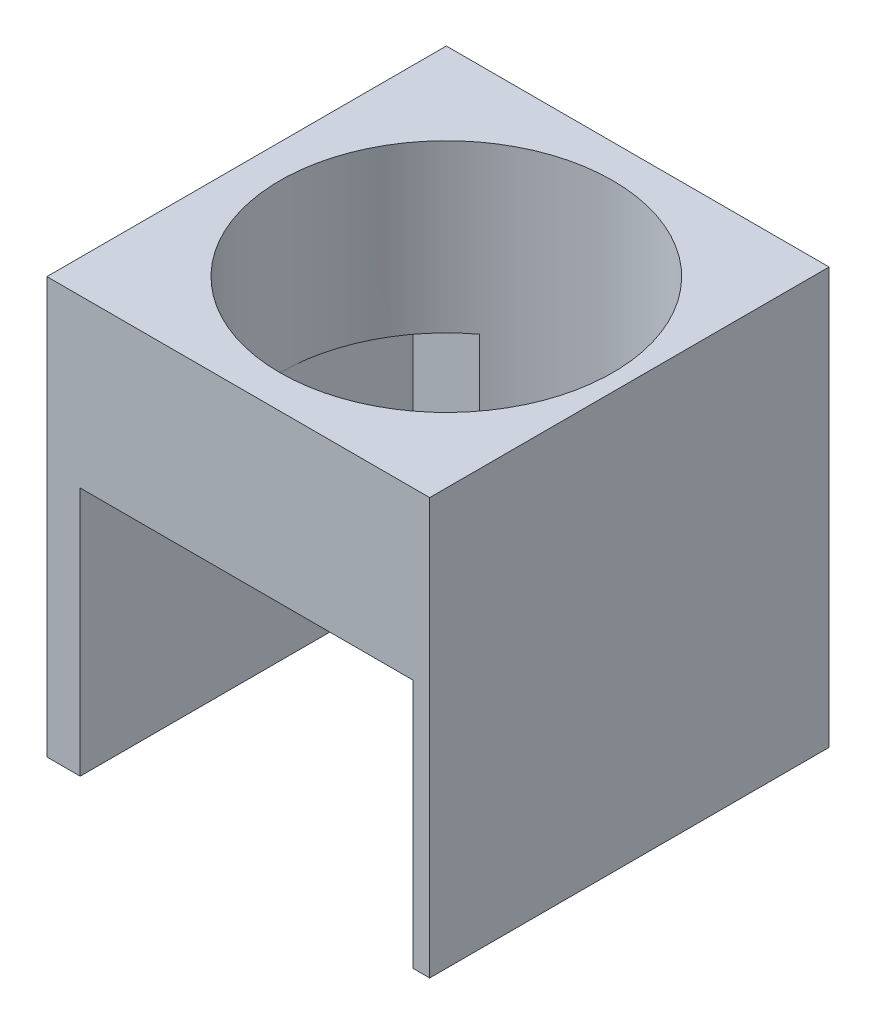
from build123d import *

# Parameters (mm, degrees)
SKETCH1_W                      = 670
SKETCH1_H                      = 120
BOSS_EXTRUDE1_DEPTH            = 530
SKETCH2_W                      = 100
SKETCH2_H                      = 200
SKETCH2_W_2                    = 650
SKETCH2_H_2                    = 250
CUT_EXTRUDE1_DEPTH             = 100
SKETCH3_R                      = 50
CUT_EXTRUDE2_DEPTH             = 260
F_12_0_12_DIAMETER_HOLE2_D     = 12
F_12_0_12_DIAMETER_HOLE2_DEPTH = 30
F_12_0_12_DIAMETER_HOLE2_TIP   = 3.605163714
SKETCH8_W                      = 650
SKETCH8_H                      = 50
BOSS_EXTRUDE2_DEPTH            = 5
SKETCH9_W                      = 10
SKETCH9_H                      = 250
CUT_EXTRUDE3_DEPTH             = 717
CUT_EXTRUDE4_DEPTH             = 5
SKETCH11_W                     = 10
SKETCH11_H                     = 100
BOSS_EXTRUDE3_DEPTH            = 78
BOSS_EXTRUDE3_2_DEPTH          = 78
BOSS_EXTRUDE3_3_DEPTH          = 78
SKETCH12_W                     = 20
SKETCH12_H                     = 30
CUT_EXTRUDE5_DEPTH             = 80
SKETCH15_W                     = 30
SKETCH15_H                     = 23.536156656
SKETCH15_H_2                   = 28.986603691
CUT_EXTRUDE7_DEPTH             = 35
SHELL1_T                       = -3
SKETCH16_W                     = 14
SKETCH16_H                     = 14
CUT_EXTRUDE8_DEPTH             = 35
SKETCH17_W                     = 5.729882812
SKETCH17_H                     = 17.428393554
SKETCH17_W_2                   = 13.369726562
SKETCH17_H_2                   = 3.342431641
BOSS_EXTRUDE4_DEPTH            = 5
SKETCH18_W                     = 670
SKETCH18_H                     = 280
CUT_EXTRUDE10_DEPTH            = 159
CUT_EXTRUDE11_DEPTH            = 863.670273187
CUT_EXTRUDE11_DEPTH_BACK       = 863.670273187
SKETCH19_W                     = 555
SKETCH19_H                     = 250
CUT_EXTRUDE12_DEPTH            = 556.450267801
CUT_EXTRUDE12_DEPTH_BACK       = 556.450267801
SKETCH20_W                     = 115
SKETCH20_H                     = 125


with BuildPart() as part:
    # Sketch1 → Boss-Extrude1 (new body)
    with BuildSketch(Plane(origin=(0, 0, 0), x_dir=(1, 0, 0), z_dir=(0, 1, 0))):
        with Locations((335, 60)):
            Rectangle(SKETCH1_W, SKETCH1_H)
    extrude(amount=BOSS_EXTRUDE1_DEPTH)

    # Sketch2 → Cut-Extrude1 (cut)
    with BuildSketch(Plane.XY):
        with Locations((60, 380)):
            Rectangle(SKETCH2_W, SKETCH2_H)
        with Locations((170, 380)):
            Rectangle(SKETCH2_W, SKETCH2_H)
        with Locations((280, 380)):
            Rectangle(SKETCH2_W, SKETCH2_H)
        with Locations((390, 380)):
            Rectangle(SKETCH2_W, SKETCH2_H)
        with Locations((500, 380)):
            Rectangle(SKETCH2_W, SKETCH2_H)
        with Locations((610, 380)):
            Rectangle(SKETCH2_W, SKETCH2_H)
        with Locations((335, 135)):
            Rectangle(SKETCH2_W_2, SKETCH2_H_2)
    extrude(amount=-CUT_EXTRUDE1_DEPTH, mode=Mode.SUBTRACT)

    # Sketch3 → Cut-Extrude2 (cut)
    with BuildSketch(Plane(origin=(0, 530, 0), x_dir=(1, 0, 0), z_dir=(0, 1, 0))):
        with Locations(Location((60, 60, 0), (0, 0, 270))):
            Circle(SKETCH3_R)
        with Locations(Location((170, 60, 0), (0, 0, 270))):
            Circle(SKETCH3_R)
        with Locations(Location((280, 60, 0), (0, 0, 270))):
            Circle(SKETCH3_R)
        with Locations(Location((390, 60, 0), (0, 0, 270))):
            Circle(SKETCH3_R)
        with Locations(Location((500, 60, 0), (0, 0, 270))):
            Circle(SKETCH3_R)
        with Locations(Location((610, 60, 0), (0, 0, 270))):
            Circle(SKETCH3_R)
    extrude(amount=-CUT_EXTRUDE2_DEPTH, mode=Mode.SUBTRACT)

    # Ø12.0 (12) Diameter Hole2
    with Locations(Plane(origin=(59.704642413, 270, -102.411697903), x_dir=(0, 0, 1), z_dir=(0, 1, 0))):
        with Locations((0, 0), (-0.195888006, 111.8520513), (0.014838595, 221.167624818), (-0.341843303, 331.364008353), (0.657723149, 441.008646429), (1.288998006, 549.811854685)):
            Hole(F_12_0_12_DIAMETER_HOLE2_D / 2, depth=F_12_0_12_DIAMETER_HOLE2_DEPTH)
            with Locations((0, 0, -(F_12_0_12_DIAMETER_HOLE2_DEPTH + F_12_0_12_DIAMETER_HOLE2_TIP / 2))):  # 118° drill point
                Cone(0, F_12_0_12_DIAMETER_HOLE2_D / 2, F_12_0_12_DIAMETER_HOLE2_TIP, mode=Mode.SUBTRACT)

    # Sketch8 → Boss-Extrude2 (add)
    with BuildSketch(Plane.XY):
        with Locations((335, 305)):
            Rectangle(SKETCH8_W, SKETCH8_H)
    extrude(amount=-BOSS_EXTRUDE2_DEPTH)

    # Sketch9 → Cut-Extrude3 (cut)
    with BuildSketch(Plane(origin=(670, 0, 0), x_dir=(0, 0, -1), z_dir=(1, 0, 0))):
        with Locations((15, 135)):
            Rectangle(SKETCH9_W, SKETCH9_H)
    extrude(amount=-CUT_EXTRUDE3_DEPTH, mode=Mode.SUBTRACT)

    # Sketch10 → Cut-Extrude4 (cut)
    with BuildSketch(Plane(origin=(0, 10, 0), x_dir=(1, 0, 0), z_dir=(0, 1, 0))):
        Polygon((365, 61.943560596), (350, 87.924322709), (320, 87.924322709), (305, 61.943560596), (320, 35.962798482), (350, 35.962798482), align=None)
    extrude(amount=-CUT_EXTRUDE4_DEPTH, mode=Mode.SUBTRACT)

    # Sketch12 → Cut-Extrude5 (cut)
    with BuildSketch(Plane.XY.offset(-100)):
        with Locations((85.198613037, 245)):
            Rectangle(SKETCH12_W, SKETCH12_H)
        with Locations((195.198613037, 245)):
            Rectangle(SKETCH12_W, SKETCH12_H)
        with Locations((305.198613037, 245)):
            Rectangle(SKETCH12_W, SKETCH12_H)
        with Locations((415.198613037, 245)):
            Rectangle(SKETCH12_W, SKETCH12_H)
        with Locations((525.198613037, 245)):
            Rectangle(SKETCH12_W, SKETCH12_H)
        with Locations((635.198613037, 245)):
            Rectangle(SKETCH12_W, SKETCH12_H)
    extrude(amount=-CUT_EXTRUDE5_DEPTH, mode=Mode.SUBTRACT)

    # Sketch17 → Boss-Extrude4 (add)
    # profile 1 of 9: a face of its own
    with BuildSketch(Plane.XY):
        with BuildLine():
            Line((527.508830928, 289.835452458), (527.508830928, 307.263846012))
            Line((527.508830928, 307.263846012), (534.861434459, 307.263846012))
            add(Edge.make_bspline(
                [(534.861434459, 307.263846012), (535.181337774, 307.258256848), (535.803061116, 307.24739446), (536.703508491, 307.139069344), (537.544992916, 306.975202489), (538.325061607, 306.737496792), (539.040841948, 306.426020155), (539.698044515, 306.051894954), (540.290333057, 305.605079277), (540.822348212, 305.090232636), (541.284521701, 304.502523111), (541.692171296, 303.852565801), (542.030284458, 303.129762281), (542.309377095, 302.341316546), (542.5243908, 301.484161689), (542.679660381, 300.560045938), (542.773357357, 299.567500804), (542.783368073, 298.883107022), (542.788518428, 298.530997273)],
                knots=[0, 0, 0, 0, 1.135059408, 2.20595691, 3.214417064, 4.174978569, 5.094187092, 5.980001006, 6.853065862, 7.720814779, 8.600404634, 9.50058483, 10.438414914, 11.426825708, 12.465239141, 13.571113463, 14.750376389, 16, 16, 16, 16], degree=3))
            add(Edge.make_bspline(
                [(542.788518428, 298.530997273), (542.781740751, 298.180151665), (542.768592871, 297.499553336), (542.676885992, 296.511518461), (542.516733301, 295.591080531), (542.296748778, 294.736450427), (542.003051046, 293.953120444), (541.654236167, 293.233205539), (541.233025793, 292.585291498), (540.753136904, 292.000029304), (540.204772188, 291.484681411), (539.587651059, 291.044279297), (538.910779309, 290.668464036), (538.169670382, 290.361903209), (537.364073889, 290.124869172), (536.495133477, 289.954199984), (535.562644449, 289.853487388), (534.920131033, 289.841584621), (534.58911581, 289.835452458)],
                knots=[0, 0, 0, 0, 1.228418252, 2.382983832, 3.470276728, 4.496757894, 5.468023682, 6.394867725, 7.292157164, 8.167372942, 9.039072913, 9.918728341, 10.815246345, 11.744296628, 12.720973084, 13.750736166, 14.841206188, 16, 16, 16, 16], degree=3))
            Line((534.58911581, 289.835452458), (527.508830928, 289.835452458))
        make_face()
        with BuildLine():
            Line((533.238713741, 291.745413395), (534.048208904, 291.745413395))
            add(Edge.make_bspline(
                [(534.048208904, 291.745413395), (534.172894012, 291.749291978), (534.413033311, 291.756761998), (534.758676231, 291.825976613), (535.075745017, 291.938271137), (535.365749176, 292.094802589), (535.623404602, 292.300450923), (535.848862806, 292.551404902), (536.04776914, 292.844737637), (536.217685755, 293.190205032), (536.364284647, 293.596533622), (536.481764702, 294.076367921), (536.592118304, 294.630928744), (536.673672739, 295.265507643), (536.740044562, 295.978448886), (536.788346679, 296.768428292), (536.812018936, 297.636801208), (536.817188964, 298.241258393), (536.819890499, 298.55711002)],
                knots=[0, 0, 0, 0, 0.728710832, 1.403472396, 2.052289494, 2.690292559, 3.321919393, 3.970736491, 4.656696891, 5.388631723, 6.217040872, 7.17856157, 8.275589967, 9.523440737, 10.918935818, 12.463926104, 14.152268318, 16, 16, 16, 16], degree=3))
            add(Edge.make_bspline(
                [(536.819890499, 298.55711002), (536.8171426, 298.871715251), (536.811863063, 299.476166083), (536.7886758, 300.343334385), (536.739579947, 301.133216935), (536.674703848, 301.843934916), (536.589660404, 302.476324031), (536.488366458, 303.031681737), (536.362441588, 303.507627045), (536.222158727, 303.914921549), (536.050140993, 304.256514038), (535.858357073, 304.554097881), (535.62547107, 304.79746827), (535.36991257, 305.004888479), (535.079348843, 305.160875844), (534.761320266, 305.273944358), (534.414185903, 305.34216807), (534.172870641, 305.349893944), (534.048208904, 305.353885075)],
                knots=[0, 0, 0, 0, 1.842836665, 3.540640921, 5.080358154, 6.47765669, 7.719902824, 8.816971715, 9.781579111, 10.601733135, 11.334613876, 12.017393917, 12.666641099, 13.29908421, 13.937911793, 14.587567384, 15.270347425, 16, 16, 16, 16], degree=3))
            Line((534.048208904, 305.353885075), (533.238713741, 305.353885075))
            Line((533.238713741, 305.353885075), (533.238713741, 291.745413395))
        make_face(mode=Mode.SUBTRACT)
    # profile 2 of 9: a face of its own
    with BuildSketch(Plane.XY):
        with Locations((547.563420772, 298.549649235)):
            Rectangle(SKETCH17_W, SKETCH17_H)
    # profile 3 of 9: a face of its own
    with BuildSketch(Plane.XY):
        Polygon((564.514324092, 307.263846012), (564.514324092, 305.115139958), (558.545696163, 305.115139958), (558.545696163, 299.862747379), (563.559343624, 299.862747379), (563.559343624, 297.714041325), (558.545696163, 297.714041325), (558.545696163, 289.835452458), (552.81581335, 289.835452458), (552.81581335, 307.263846012), align=None)
    # profile 4 of 9: a face of its own
    with BuildSketch(Plane.XY):
        Polygon((577.645305538, 307.263846012), (577.645305538, 305.115139958), (571.676677608, 305.115139958), (571.676677608, 299.862747379), (576.690325069, 299.862747379), (576.690325069, 297.714041325), (571.676677608, 297.714041325), (571.676677608, 289.835452458), (565.946794795, 289.835452458), (565.946794795, 307.263846012), align=None)
    # profile 5 of 9: a face of its own
    with BuildSketch(Plane.XY):
        with Locations((584.330168819, 287.448001286)):
            Rectangle(SKETCH17_W_2, SKETCH17_H_2)
    # profile 6 of 9: a face of its own
    with BuildSketch(Plane.XY):
        with BuildLine():
            Line((605.578484249, 307.263846012), (605.578484249, 295.602639195))
            add(Edge.make_bspline(
                [(605.578484249, 295.602639195), (605.574209777, 295.35989389), (605.565919345, 294.889083964), (605.480877158, 294.20653885), (605.349958188, 293.569747554), (605.15926554, 292.978838165), (604.911867049, 292.436847071), (604.616163877, 291.936663973), (604.260702644, 291.487723021), (603.847299908, 291.08966617), (603.386881991, 290.731670113), (602.867295001, 290.425440037), (602.293741958, 290.168488385), (601.66690529, 289.960990771), (600.988052682, 289.797299786), (600.254912883, 289.679078851), (599.467035781, 289.60781007), (598.923618241, 289.60048219), (598.643684673, 289.59670734)],
                knots=[0, 0, 0, 0, 1.108173197, 2.149326602, 3.136215123, 4.073726706, 4.978516626, 5.852185058, 6.72141202, 7.584905625, 8.467554395, 9.379216169, 10.332422268, 11.332766067, 12.390653242, 13.518530507, 14.721707419, 16, 16, 16, 16], degree=3))
            add(Edge.make_bspline(
                [(598.643684673, 289.59670734), (598.373688491, 289.600411437), (597.851346557, 289.607577482), (597.093280473, 289.679448684), (596.387523889, 289.797736542), (595.733050135, 289.960122315), (595.130189942, 290.169220301), (594.579048171, 290.42623041), (594.078350789, 290.732835498), (593.633858028, 291.090104794), (593.234289459, 291.486851767), (592.899913678, 291.940746827), (592.609043638, 292.435866034), (592.375223767, 292.980322997), (592.191754821, 293.570441519), (592.063541006, 294.20666921), (591.983676196, 294.889343196), (591.974661767, 295.359932437), (591.970012569, 295.602639195)],
                knots=[0, 0, 0, 0, 1.258901956, 2.435505865, 3.547148904, 4.59359074, 5.576649289, 6.5183682, 7.424469602, 8.307507093, 9.172751023, 10.042627298, 10.928839176, 11.845659241, 12.799442865, 13.80597989, 14.868432463, 16, 16, 16, 16], degree=3))
            Line((591.970012569, 295.602639195), (591.970012569, 307.263846012))
            Line((591.970012569, 307.263846012), (597.699895381, 307.263846012))
            Line((597.699895381, 307.263846012), (597.699895381, 295.457153889))
            add(Edge.make_bspline(
                [(597.699895381, 295.457153889), (597.700816195, 295.287996189), (597.702584578, 294.963135903), (597.729908723, 294.499051493), (597.768241004, 294.079064133), (597.828226169, 293.705517832), (597.90066041, 293.377063412), (597.989882091, 293.09281535), (598.094998068, 292.852496478), (598.225239063, 292.654232043), (598.380826623, 292.495135011), (598.55368342, 292.353231761), (598.757556996, 292.238543846), (598.987648905, 292.146224908), (599.243380948, 292.070549638), (599.526120553, 292.020376099), (599.83553351, 291.990763905), (600.049971942, 291.986424568), (600.161954402, 291.984158512)],
                knots=[0, 0, 0, 0, 1.622370975, 3.115695595, 4.458049099, 5.666011203, 6.742434742, 7.681714947, 8.519814998, 9.250928664, 9.942747364, 10.646898194, 11.389596108, 12.175933929, 13.021386247, 13.943159715, 14.925891993, 16, 16, 16, 16], degree=3))
            add(Edge.make_bspline(
                [(600.161954402, 291.984158512), (600.283927219, 291.987190593), (600.521124756, 291.993087005), (600.86597014, 292.03390861), (601.187714881, 292.103380086), (601.484890424, 292.205377303), (601.758665297, 292.332852529), (602.012761516, 292.484567923), (602.236391413, 292.674631152), (602.439076761, 292.888441291), (602.620738276, 293.128529789), (602.771757722, 293.399928575), (602.905501548, 293.697121508), (603.005823683, 294.025060118), (603.089837826, 294.379999499), (603.146989706, 294.763086929), (603.186210275, 295.174074524), (603.189394751, 295.457053988), (603.191033077, 295.602639195)],
                knots=[0, 0, 0, 0, 1.083870311, 2.107775948, 3.08105344, 4.003637981, 4.893545291, 5.761570557, 6.624657808, 7.49233129, 8.376387281, 9.291996285, 10.246843261, 11.267344133, 12.334180325, 13.486053461, 14.706643157, 16, 16, 16, 16], degree=3))
            Line((603.191033077, 295.602639195), (603.191033077, 307.263846012))
            Line((603.191033077, 307.263846012), (605.578484249, 307.263846012))
        make_face()
    # profile 7 of 9: a face of its own
    with BuildSketch(Plane.XY):
        with BuildLine():
            Line((619.731593227, 302.015183827), (616.739818477, 301.526502415))
            add(Edge.make_bspline(
                [(616.739818477, 301.526502415), (616.748849224, 301.670726223), (616.765660669, 301.939210177), (616.78429066, 302.312269209), (616.796668381, 302.625642376), (616.798628236, 302.814722915), (616.799504756, 302.899286839)],
                knots=[0, 0, 0, 0, 1.261802504, 2.348944521, 3.261585937, 4, 4, 4, 4], degree=3))
            add(Edge.make_bspline(
                [(616.799504756, 302.899286839), (616.798306068, 303.007660677), (616.795968139, 303.219033721), (616.750451916, 303.523894877), (616.694806916, 303.811547356), (616.604352699, 304.076787391), (616.488181329, 304.320314265), (616.348943917, 304.543955606), (616.184187178, 304.745078709), (615.995833421, 304.928129987), (615.778009957, 305.083200131), (615.536269472, 305.218702836), (615.269765326, 305.333844758), (614.978065514, 305.431346685), (614.660683072, 305.504624438), (614.319025281, 305.556776695), (613.952471696, 305.585673441), (613.699597795, 305.590260771), (613.568984889, 305.592630192)],
                knots=[0, 0, 0, 0, 1.079280541, 2.105035848, 3.067950317, 3.99715044, 4.889989748, 5.753421302, 6.617030865, 7.476358039, 8.364190572, 9.274590025, 10.235106994, 11.254473582, 12.337095886, 13.478601727, 14.697662529, 16, 16, 16, 16], degree=3))
            add(Edge.make_bspline(
                [(613.568984889, 305.592630192), (613.391954632, 305.58912286), (613.059112606, 305.582528579), (612.595688488, 305.495339748), (612.198743126, 305.361419257), (611.87165349, 305.163811893), (611.613188167, 304.909795747), (611.433841092, 304.593316589), (611.323009072, 304.224665915), (611.313400221, 303.959558324), (611.308367061, 303.820693775)],
                knots=[0, 0, 0, 0, 1.294917039, 2.43462794, 3.440028966, 4.347597256, 5.210608309, 6.06356377, 6.985685997, 8, 8, 8, 8], degree=3))
            add(Edge.make_bspline(
                [(611.308367061, 303.820693775), (611.317562032, 303.705133219), (611.336106628, 303.472068433), (611.47315858, 303.132808312), (611.695999602, 302.811560885), (612.009295906, 302.510664216), (612.404107796, 302.221967273), (612.884407504, 301.948533431), (613.450813789, 301.688189695), (613.862519081, 301.536023727), (614.080048656, 301.455624958)],
                knots=[0, 0, 0, 0, 0.716839541, 1.445735977, 2.240793036, 3.131329288, 4.131129903, 5.273471266, 6.559404876, 8, 8, 8, 8], degree=3))
            add(Edge.make_bspline(
                [(614.080048656, 301.455624958), (614.335934702, 301.364918412), (614.834564244, 301.188164095), (615.547657928, 300.88707802), (616.213068388, 300.5749594), (616.829579094, 300.246613346), (617.397833174, 299.90520698), (617.914851624, 299.544556457), (618.386199073, 299.173962102), (618.807001026, 298.783874588), (619.177995113, 298.378100064), (619.4958685, 297.952745357), (619.771807525, 297.51723103), (619.991113975, 297.061458502), (620.169645242, 296.594624218), (620.292698657, 296.11024444), (620.364288243, 295.609761088), (620.37516617, 295.270864226), (620.380681514, 295.099036213)],
                knots=[0, 0, 0, 0, 1.359488612, 2.649152603, 3.874964776, 5.039588756, 6.146130126, 7.193090393, 8.194917302, 9.146793662, 10.063845301, 10.944476293, 11.803344532, 12.641736646, 13.473440096, 14.302714936, 15.139439897, 16, 16, 16, 16], degree=3))
            add(Edge.make_bspline(
                [(620.380681514, 295.099036213), (620.374476075, 294.902306495), (620.362285176, 294.515820995), (620.280160209, 293.948630617), (620.138011896, 293.409496554), (619.938489338, 292.895972278), (619.681049879, 292.411946655), (619.366518754, 291.954381076), (618.996510229, 291.525099427), (618.5710008, 291.128381035), (618.102222518, 290.765302239), (617.587803957, 290.450854345), (617.034458515, 290.187092261), (616.444107988, 289.968993032), (615.81453624, 289.801373099), (615.145337453, 289.685291013), (614.438790193, 289.606619894), (613.954683001, 289.600062276), (613.70700941, 289.59670734)],
                knots=[0, 0, 0, 0, 0.972121714, 1.909782367, 2.824924061, 3.721832975, 4.62620438, 5.527836938, 6.46026819, 7.421000932, 8.398101015, 9.385579713, 10.394244048, 11.422703992, 12.491421888, 13.608778581, 14.776629625, 16, 16, 16, 16], degree=3))
            add(Edge.make_bspline(
                [(613.70700941, 289.59670734), (613.445745367, 289.599650312), (612.939893069, 289.605348413), (612.207608113, 289.66709241), (611.525297432, 289.760984454), (610.893395078, 289.899706116), (610.309273131, 290.072394336), (609.776099392, 290.288320955), (609.295310255, 290.547303481), (608.863217672, 290.843007892), (608.478306623, 291.175775461), (608.148120946, 291.551766865), (607.86942369, 291.967163224), (607.639947144, 292.421521488), (607.466477665, 292.917583541), (607.339164663, 293.449829748), (607.264537999, 294.021332449), (607.254747521, 294.414908557), (607.249700069, 294.617815586)],
                knots=[0, 0, 0, 0, 1.342201143, 2.598733168, 3.773451092, 4.878874364, 5.91991243, 6.900006476, 7.829142054, 8.72062616, 9.585588575, 10.436728592, 11.283829734, 12.149664931, 13.044964919, 13.977937424, 14.957531465, 16, 16, 16, 16], degree=3))
            add(Edge.make_bspline(
                [(607.249700069, 294.617815586), (607.250803815, 294.692425759), (607.253213998, 294.855347393), (607.260452266, 295.122772538), (607.275636683, 295.433682216), (607.29037174, 295.656130545), (607.298195171, 295.774237248)],
                knots=[0, 0, 0, 0, 0.773500207, 1.689044709, 2.77302154, 4, 4, 4, 4], degree=3))
            Line((607.298195171, 295.774237248), (610.36457777, 296.337526509))
            add(Edge.make_bspline(
                [(610.36457777, 296.337526509), (610.326952988, 296.136337493), (610.255606535, 295.754830366), (610.178678473, 295.21219969), (610.124206629, 294.733311493), (610.11767002, 294.435147371), (610.114641475, 294.297001835)],
                knots=[0, 0, 0, 0, 1.192988372, 2.262218769, 3.194850416, 4, 4, 4, 4], degree=3))
            add(Edge.make_bspline(
                [(610.114641475, 294.297001835), (610.116191817, 294.183708768), (610.119182568, 293.965156219), (610.159053378, 293.648552813), (610.215988606, 293.352999663), (610.302906772, 293.079707227), (610.411206928, 292.826307836), (610.544682453, 292.59538211), (610.704385489, 292.386485019), (610.887496571, 292.200099922), (611.094689168, 292.033628705), (611.327456494, 291.892756696), (611.58347653, 291.771733922), (611.864681562, 291.677479524), (612.167961721, 291.596080628), (612.497219749, 291.548235723), (612.849461228, 291.512043782), (613.092629543, 291.508500084), (613.218327999, 291.506668278)],
                knots=[0, 0, 0, 0, 1.135776692, 2.191015738, 3.19649269, 4.151244236, 5.061952528, 5.956281389, 6.819534407, 7.692823504, 8.571441916, 9.478554956, 10.416037156, 11.406231466, 12.450054172, 13.561596327, 14.739541482, 16, 16, 16, 16], degree=3))
            add(Edge.make_bspline(
                [(613.218327999, 291.506668278), (613.423996012, 291.510791273), (613.810619321, 291.518541853), (614.349272542, 291.616708407), (614.810575885, 291.768742445), (615.189785268, 291.991387532), (615.490778961, 292.278756613), (615.698005174, 292.637320004), (615.824813318, 293.05638326), (615.837728413, 293.355975238), (615.844524288, 293.513619419)],
                knots=[0, 0, 0, 0, 1.308765556, 2.460272085, 3.475015317, 4.388076298, 5.239673503, 6.095681635, 6.997954785, 8, 8, 8, 8], degree=3))
            add(Edge.make_bspline(
                [(615.844524288, 293.513619419), (615.833808824, 293.638242951), (615.811807312, 293.894126055), (615.644884004, 294.264515838), (615.382382362, 294.620631473), (615.016807277, 294.962984909), (614.551376589, 295.293471235), (613.986957743, 295.616730224), (613.322148235, 295.933112033), (612.83677959, 296.119639164), (612.580430889, 296.21815395)],
                knots=[0, 0, 0, 0, 0.667930748, 1.371427933, 2.146459016, 3.034714139, 4.04893387, 5.207327294, 6.525042705, 8, 8, 8, 8], degree=3))
            add(Edge.make_bspline(
                [(612.580430889, 296.21815395), (612.374354345, 296.29679374), (611.970646869, 296.450850434), (611.394079385, 296.713586304), (610.853066711, 296.987016804), (610.357486361, 297.288235735), (609.896382561, 297.599610528), (609.477036946, 297.932256792), (609.09841673, 298.284556341), (608.758710772, 298.653375077), (608.457302107, 299.038989264), (608.199448649, 299.444659231), (607.977533299, 299.866789834), (607.798609588, 300.308107488), (607.65975715, 300.767821241), (607.559616231, 301.244439392), (607.497905054, 301.739995674), (607.491630423, 302.075933546), (607.488445186, 302.246468159)],
                knots=[0, 0, 0, 0, 1.249558333, 2.447906163, 3.58867143, 4.682264114, 5.731748367, 6.739728761, 7.711906036, 8.659384707, 9.578321416, 10.481344598, 11.379544271, 12.277135726, 13.175418307, 14.097160112, 15.034047388, 16, 16, 16, 16], degree=3))
            add(Edge.make_bspline(
                [(607.488445186, 302.246468159), (607.49282555, 302.439538736), (607.501402184, 302.817565692), (607.587451154, 303.36980586), (607.719291893, 303.894921371), (607.910558542, 304.389343064), (608.156192894, 304.852853762), (608.453187669, 305.288766511), (608.804241719, 305.697593471), (609.213503754, 306.066686531), (609.657214714, 306.407618241), (610.14376173, 306.697651931), (610.658716537, 306.950861947), (611.210636666, 307.148827868), (611.791820619, 307.313252612), (612.408080529, 307.421140415), (613.056315391, 307.490701612), (613.499160755, 307.498567824), (613.725661373, 307.502591129)],
                knots=[0, 0, 0, 0, 1.01033566, 1.978209831, 2.919499157, 3.840961976, 4.746855014, 5.660740114, 6.597989116, 7.56120833, 8.541877795, 9.523498025, 10.522416858, 11.542172371, 12.589598349, 13.681636521, 14.814234488, 16, 16, 16, 16], degree=3))
            add(Edge.make_bspline(
                [(613.725661373, 307.502591129), (613.968269855, 307.498219033), (614.438190994, 307.489750488), (615.120391152, 307.426787419), (615.755073228, 307.319142339), (616.345153155, 307.171557286), (616.887304575, 306.977590666), (617.384933999, 306.742393454), (617.834452216, 306.46201507), (618.236961315, 306.139451502), (618.593086714, 305.773322851), (618.897467704, 305.361641069), (619.158701245, 304.909408454), (619.366684143, 304.412232174), (619.529870326, 303.873247147), (619.649133834, 303.29158184), (619.720420497, 302.667301443), (619.72779778, 302.236712324), (619.731593227, 302.015183827)],
                knots=[0, 0, 0, 0, 1.248314423, 2.417925914, 3.521398822, 4.558068205, 5.543720209, 6.479599284, 7.385061127, 8.263440163, 9.127722873, 10.00561236, 10.891325273, 11.808802823, 12.772251995, 13.784947978, 14.860405143, 16, 16, 16, 16], degree=3))
        make_face()
    # profile 8 of 9: a face of its own
    with BuildSketch(Plane.XY):
        Polygon((633.989153194, 307.263846012), (633.989153194, 305.115139958), (628.020525264, 305.115139958), (628.020525264, 300.340237614), (633.034172725, 300.340237614), (633.034172725, 298.191531559), (628.020525264, 298.191531559), (628.020525264, 291.984158512), (634.944133663, 291.984158512), (634.944133663, 289.835452458), (622.290642452, 289.835452458), (622.290642452, 307.263846012), align=None)
    # profile 9 of 9: a face of its own
    with BuildSketch(Plane.XY):
        with BuildLine():
            Line((636.376604366, 289.835452458), (636.376604366, 307.263846012))
            Line((636.376604366, 307.263846012), (643.990335369, 307.263846012))
            add(Edge.make_bspline(
                [(643.990335369, 307.263846012), (644.237946498, 307.261150834), (644.721600887, 307.25588639), (645.426490561, 307.189203683), (646.094808274, 307.090496236), (646.724915796, 306.949857504), (647.317873659, 306.767252686), (647.871119087, 306.542146), (648.390701058, 306.282329135), (648.864494846, 305.976472528), (649.295093616, 305.642889252), (649.669668547, 305.279483604), (649.990389523, 304.894749072), (650.250664962, 304.483256345), (650.454275633, 304.048690948), (650.59581384, 303.587791605), (650.684089268, 303.104102537), (650.695510601, 302.772834174), (650.701311397, 302.604585835)],
                knots=[0, 0, 0, 0, 1.303269877, 2.545653735, 3.724355284, 4.8584284, 5.941462088, 6.987020715, 8.000098032, 8.995332524, 9.951400474, 10.863507538, 11.737823931, 12.582415999, 13.420128714, 14.25671499, 15.114600608, 16, 16, 16, 16], degree=3))
            add(Edge.make_bspline(
                [(650.701311397, 302.604585835), (650.698282873, 302.472674957), (650.692382063, 302.215658276), (650.651041486, 301.838684287), (650.580643818, 301.480313933), (650.481036683, 301.139915259), (650.347814833, 300.820175594), (650.191279492, 300.517863507), (650.009772227, 300.230553342), (649.788675198, 299.970497982), (649.548268341, 299.722842359), (649.274558803, 299.497116911), (648.974487035, 299.288655528), (648.642526299, 299.104010513), (648.287619671, 298.928055749), (647.899038177, 298.784921972), (647.486819978, 298.644749395), (647.19793098, 298.577036306), (647.049257183, 298.54218845)],
                knots=[0, 0, 0, 0, 1.057156483, 2.059775939, 3.035078039, 3.981068617, 4.897189472, 5.80650904, 6.70770952, 7.613691521, 8.536886357, 9.470937334, 10.45233069, 11.461024139, 12.51295332, 13.623444893, 14.776929983, 16, 16, 16, 16], degree=3))
            add(Edge.make_bspline(
                [(647.049257183, 298.54218845), (647.19164695, 298.499279419), (647.467865022, 298.416041346), (647.856360945, 298.265600017), (648.211652989, 298.111536308), (648.524185739, 297.936781388), (648.807636894, 297.762122504), (649.047122259, 297.564301324), (649.255235567, 297.361673563), (649.425188343, 297.135464734), (649.570253643, 296.882344437), (649.694827156, 296.586596707), (649.815179167, 296.247423665), (649.917667348, 295.859098311), (650.004750555, 295.423699276), (650.088222437, 294.944027189), (650.153853601, 294.416024546), (650.187587341, 294.048412906), (650.2051692, 293.856815525)],
                knots=[0, 0, 0, 0, 1.149282524, 2.229462177, 3.219229774, 4.139917433, 4.995948464, 5.788695735, 6.536448429, 7.236319808, 7.968460079, 8.78645307, 9.713791991, 10.749194692, 11.887975363, 13.146018663, 14.512518948, 16, 16, 16, 16], degree=3))
            add(Edge.make_bspline(
                [(650.2051692, 293.856815525), (650.225980287, 293.627849833), (650.265975604, 293.187817268), (650.348933081, 292.554613589), (650.44386163, 291.974357025), (650.555874504, 291.44528724), (650.681301216, 290.967898855), (650.821280597, 290.540469593), (650.979920039, 290.165788217), (651.10484481, 289.941461656), (651.163880062, 289.835452458)],
                knots=[0, 0, 0, 0, 1.324580516, 2.545615266, 3.678710841, 4.711533017, 5.660403917, 6.521349952, 7.301239649, 8, 8, 8, 8], degree=3))
            Line((651.163880062, 289.835452458), (645.213904094, 289.835452458))
            add(Edge.make_bspline(
                [(645.213904094, 289.835452458), (645.12229736, 290.069847279), (644.935171241, 290.548648246), (644.7595281, 291.319414791), (644.64846922, 292.142514735), (644.635117598, 292.70994511), (644.628232479, 293.002555653)],
                knots=[0, 0, 0, 0, 0.930410518, 1.900560147, 2.917368081, 4, 4, 4, 4], degree=3))
            Line((644.628232479, 293.002555653), (644.605850124, 294.002300831))
            Line((644.605850124, 294.002300831), (644.579737377, 295.266903874))
            add(Edge.make_bspline(
                [(644.579737377, 295.266903874), (644.573694669, 295.477395004), (644.562357007, 295.872330118), (644.469348432, 296.426164013), (644.30178735, 296.894645884), (644.073222546, 297.287223005), (643.766741442, 297.590613479), (643.39104803, 297.804152917), (642.950456912, 297.93396284), (642.634664848, 297.946292392), (642.468335247, 297.952786442)],
                knots=[0, 0, 0, 0, 1.295300309, 2.430314163, 3.439929415, 4.342995669, 5.203512789, 6.060756153, 6.978588463, 8, 8, 8, 8], degree=3))
            Line((642.468335247, 297.952786442), (642.106487178, 297.952786442))
            Line((642.106487178, 297.952786442), (642.106487178, 289.835452458))
            Line((642.106487178, 289.835452458), (636.376604366, 289.835452458))
        make_face()
        with BuildLine():
            Line((642.106487178, 299.862747379), (642.617550945, 299.862747379))
            add(Edge.make_bspline(
                [(642.617550945, 299.862747379), (642.722054451, 299.865172716), (642.925280724, 299.869889229), (643.220054897, 299.898289891), (643.494111408, 299.951809873), (643.749840966, 300.021017819), (643.984372137, 300.114851792), (644.200147241, 300.225818296), (644.391160406, 300.362685327), (644.565327067, 300.516342321), (644.718148635, 300.691986294), (644.850351299, 300.889034217), (644.961199162, 301.106225057), (645.056078491, 301.342818683), (645.125883912, 301.600830857), (645.173262731, 301.879472914), (645.203404658, 302.177423605), (645.207875435, 302.383174491), (645.210173702, 302.488943669)],
                knots=[0, 0, 0, 0, 1.184986479, 2.304423995, 3.352332712, 4.347714965, 5.303263624, 6.211353909, 7.091434645, 7.960150225, 8.839440182, 9.723126897, 10.64371617, 11.599264829, 12.608232147, 13.667459739, 14.800924404, 16, 16, 16, 16], degree=3))
            add(Edge.make_bspline(
                [(645.210173702, 302.488943669), (645.207875435, 302.594712847), (645.203404658, 302.800463732), (645.173262731, 303.098414423), (645.125883912, 303.37705648), (645.056078491, 303.635068654), (644.961199162, 303.87166228), (644.850351299, 304.08885312), (644.718148635, 304.285901043), (644.565327067, 304.461545017), (644.391160406, 304.61520201), (644.200147241, 304.752069041), (643.984372137, 304.863035546), (643.749840966, 304.956869518), (643.494111408, 305.026077464), (643.220054897, 305.079597446), (642.925280724, 305.107998108), (642.722054451, 305.112714621), (642.617550945, 305.115139958)],
                knots=[0, 0, 0, 0, 1.199075596, 2.332540261, 3.391767853, 4.400735171, 5.35628383, 6.276873103, 7.160559818, 8.039849775, 8.908565355, 9.788646091, 10.696736376, 11.652285035, 12.647667288, 13.695576005, 14.815013521, 16, 16, 16, 16], degree=3))
            Line((642.617550945, 305.115139958), (642.106487178, 305.115139958))
            Line((642.106487178, 305.115139958), (642.106487178, 299.862747379))
        make_face(mode=Mode.SUBTRACT)
    extrude(amount=BOSS_EXTRUDE4_DEPTH)


with BuildPart() as body_2:
    # Sketch11 → Boss-Extrude3 (new body)
    with BuildSketch(Plane.XY.offset(-100)):
        with Locations((255, 60)):
            Rectangle(SKETCH11_W, SKETCH11_H)
    extrude(amount=BOSS_EXTRUDE3_DEPTH)


with BuildPart() as body_3:
    # Sketch11 → Boss-Extrude3 2 (new body)
    with BuildSketch(Plane.XY.offset(-100)):
        with Locations((415, 60)):
            Rectangle(SKETCH11_W, SKETCH11_H)
    extrude(amount=BOSS_EXTRUDE3_2_DEPTH)


with BuildPart() as body_4:
    # Sketch11 → Boss-Extrude3 3 (new body)
    with BuildSketch(Plane.XY.offset(-100)):
        Polygon((25, 198.45686471), (325, 145.558770497), (325, 122.01775856), (345, 122.01775856), (345, 145.558770497), (645, 198.45686471), align=None)
    extrude(amount=BOSS_EXTRUDE3_3_DEPTH)

    # Sketch15 → Cut-Extrude7 (cut)
    with BuildSketch(Plane(origin=(345, 0, 0), x_dir=(0, 0, -1), z_dir=(1, 0, 0))):
        with Locations((35, 133.231921672)):
            Rectangle(SKETCH15_W, SKETCH15_H)
        with Locations((85, 130.506698154)):
            Rectangle(SKETCH15_W, SKETCH15_H_2)
    extrude(amount=-CUT_EXTRUDE7_DEPTH, mode=Mode.SUBTRACT)

    # Shell1
    shell1_openings = [body_4.faces().sort_by_distance(p)[0] for p in [
        (335, 198.45686471, -61),
    ]]
    offset(amount=SHELL1_T, openings=shell1_openings, kind=Kind.INTERSECTION)

    # Sketch16 → Cut-Extrude8 (cut)
    with BuildSketch(Plane.XZ.offset(-122.01775856)):
        with Locations((335, -60)):
            Rectangle(SKETCH16_W, SKETCH16_H)
    extrude(amount=-CUT_EXTRUDE8_DEPTH, mode=Mode.SUBTRACT)


with BuildPart() as cut_extrude10_tool:
    # Sketch18 → Cut-Extrude10 (new body)
    with BuildSketch(Plane.XY):
        with Locations((335, 140)):
            Rectangle(SKETCH18_W, SKETCH18_H)
    extrude(amount=-CUT_EXTRUDE10_DEPTH)


with BuildPart() as part_1:
    add(part.part)

    # Cut-Extrude10: cut by cut_extrude10_tool
    add(cut_extrude10_tool.part, mode=Mode.SUBTRACT)

    # Sketch19 → Cut-Extrude11 (cut, two sides: drawn at the far end of the back side and taken through both)
    with BuildSketch(Plane.XY.offset(-CUT_EXTRUDE11_DEPTH_BACK)):
        with Locations((392.5, 405)):
            Rectangle(SKETCH19_W, SKETCH19_H)
    extrude(amount=CUT_EXTRUDE11_DEPTH + CUT_EXTRUDE11_DEPTH_BACK, mode=Mode.SUBTRACT)

    # Sketch20 → Cut-Extrude12 (cut, two sides: drawn at the far end of the back side and taken through both)
    with BuildSketch(Plane.XY.offset(-CUT_EXTRUDE12_DEPTH_BACK)):
        with Locations((57.5, 342.5)):
            Rectangle(SKETCH20_W, SKETCH20_H)
    extrude(amount=CUT_EXTRUDE12_DEPTH + CUT_EXTRUDE12_DEPTH_BACK, mode=Mode.SUBTRACT)


with BuildPart() as body_2_1:
    add(body_2.part)

    # Cut-Extrude10: cut by cut_extrude10_tool
    add(cut_extrude10_tool.part, mode=Mode.SUBTRACT)


with BuildPart() as body_3_1:
    add(body_3.part)

    # Cut-Extrude10: cut by cut_extrude10_tool
    add(cut_extrude10_tool.part, mode=Mode.SUBTRACT)


with BuildPart() as body_4_1:
    add(body_4.part)

    # Cut-Extrude10: cut by cut_extrude10_tool
    add(cut_extrude10_tool.part, mode=Mode.SUBTRACT)


solid = part_1.part
